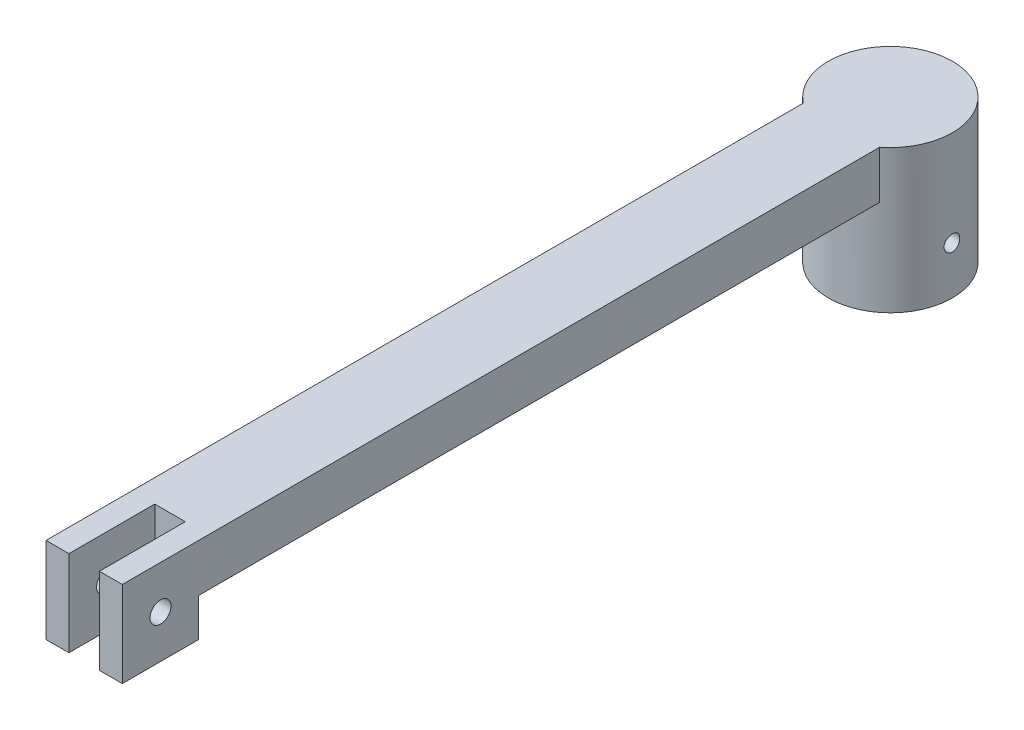
from build123d import *

# Parameters (mm, degrees)
CROQUIS_ZOCALO_R                   = 13
ZOCALO_DEPTH                       = 30
CROQUIS_ZOCALO_HUECO_R             = 8.2
ZOCALO_HUECO_DEPTH                 = 27
CROQUIS_BARRA_W                    = 16
CROQUIS_BARRA_H                    = 155
BARRA_DEPTH                        = 10
CROQUIS_HORQUILLA_W                = 16
CROQUIS_HORQUILLA_H                = 16
HORQUILLA_DEPTH                    = 18
HORQUILLA_RANURA_DEPTH             = 173.13366899
HORQUILLA_RANURA_DEPTH_BACK        = 173.13366899
CROQUIS_HORQUILLA_RANURA_W         = 6.4
CROQUIS_HORQUILLA_RANURA_H         = 20
EJE_CAMARA_Y_PRISIONERO_DEPTH      = 173.13366899
EJE_CAMARA_Y_PRISIONERO_DEPTH_BACK = 173.13366899
CROQUIS_EJES_R                     = 2.2
CROQUIS_EJES_R_2                   = 1.65


with BuildPart() as part:
    # Croquis_zocalo → Zocalo (new body)
    with BuildSketch(Plane(origin=(0, 0, 0), x_dir=(1, 0, 0), z_dir=(0, 1, 0))):
        with Locations(Location((0, 0, 0), (0, 0, 270))):
            Circle(CROQUIS_ZOCALO_R)
    extrude(amount=ZOCALO_DEPTH)

    # Croquis_zocalo_hueco → Zocalo_hueco (cut)
    with BuildSketch(Plane(origin=(0, 0, 0), x_dir=(1, 0, 0), z_dir=(0, 1, 0))):
        with Locations(Location((0, 0, 0), (0, 0, 270))):
            Circle(CROQUIS_ZOCALO_HUECO_R)
    extrude(amount=ZOCALO_HUECO_DEPTH, mode=Mode.SUBTRACT)

    # Croquis_barra → Barra (add)
    with BuildSketch(Plane(origin=(0, 20, 0), x_dir=(1, 0, 0), z_dir=(0, 1, 0))):
        with Locations((0, -77.5)):
            Rectangle(CROQUIS_BARRA_W, CROQUIS_BARRA_H)
    extrude(amount=BARRA_DEPTH)

    # Croquis_horquilla → Horquilla (add)
    with BuildSketch(Plane(origin=(0, 12, 0), x_dir=(1, 0, 0), z_dir=(0, 1, 0))):
        with Locations((0, -161)):
            Rectangle(CROQUIS_HORQUILLA_W, CROQUIS_HORQUILLA_H)
    extrude(amount=HORQUILLA_DEPTH)

    # Croquis_horquilla_ranura → Horquilla_ranura (cut, two sides: drawn at the far end of the back side and taken through both)
    with BuildSketch(Plane(origin=(0, 0, 0), x_dir=(1, 0, 0), z_dir=(0, 1, 0)).offset(-HORQUILLA_RANURA_DEPTH_BACK)):
        with Locations((0, -161)):
            Rectangle(CROQUIS_HORQUILLA_RANURA_W, CROQUIS_HORQUILLA_RANURA_H)
    extrude(amount=HORQUILLA_RANURA_DEPTH + HORQUILLA_RANURA_DEPTH_BACK, mode=Mode.SUBTRACT)

    # Croquis_ejes → Eje_camara_y_prisionero (cut, two sides: drawn at the far end of the back side and taken through both)
    with BuildSketch(Plane(origin=(0, 0, 0), x_dir=(0, 0, -1), z_dir=(1, 0, 0)).offset(-EJE_CAMARA_Y_PRISIONERO_DEPTH_BACK)):
        with Locations((-161, 21)):
            Circle(CROQUIS_EJES_R)
        with Locations(Location((0, 10, 0), (0, 0, 180))):
            Circle(CROQUIS_EJES_R_2)
    extrude(amount=EJE_CAMARA_Y_PRISIONERO_DEPTH + EJE_CAMARA_Y_PRISIONERO_DEPTH_BACK, mode=Mode.SUBTRACT)


solid = part.part
